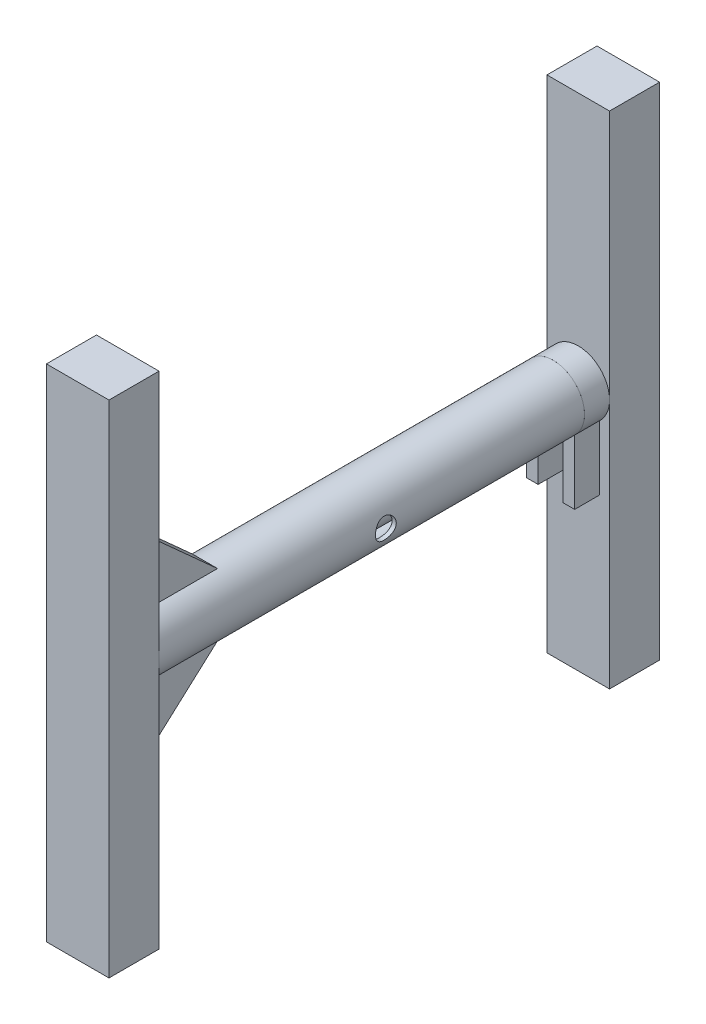
from build123d import *

# Parameters (mm, degrees)
SKETCH1_W              = 25
SKETCH1_H              = 200
BOSS_EXTRUDE1_DEPTH    = 20
BOSS_EXTRUDE2_START    = 200
SKETCH1_2_W            = 25
SKETCH1_2_H            = 200
BOSS_EXTRUDE2_DEPTH    = 20
SKETCH3_R              = 7.5
BOSS_EXTRUDE4_DEPTH    = 180
SKETCH4_R              = 12.5
SKETCH4_R_2            = 10.847914671
BOSS_EXTRUDE6_DEPTH    = 170
CUT_EXTRUDE1_START     = 8
SKETCH5_R              = 4.15951276
CUT_EXTRUDE1_DEPTH     = 206
SKETCH9_R              = 12.5
BOSS_EXTRUDE7_DEPTH    = 10
SKETCH10_W             = 4.542152159
SKETCH10_H             = 38.840988947
BOSS_EXTRUDE8_DEPTH    = 10
SKETCH10_W_2           = 4.617563116
SKETCH10_H_2           = 40.163970658
BOSS_EXTRUDE8_2_DEPTH  = 10
BOSS_EXTRUDE10_DEPTH   = 5
BOSS_EXTRUDE10_2_DEPTH = 5


with BuildPart() as part:
    # Sketch1 → Boss-Extrude1 (new body)
    with BuildSketch(Plane.XY):
        Rectangle(SKETCH1_W, SKETCH1_H)
    extrude(amount=BOSS_EXTRUDE1_DEPTH)



with BuildPart() as body_2:
    # Sketch1<2> → Boss-Extrude2 (new body)
    with BuildSketch(Plane.XY.offset(BOSS_EXTRUDE2_START)):
        Rectangle(SKETCH1_2_W, SKETCH1_2_H)
    extrude(amount=BOSS_EXTRUDE2_DEPTH)


with BuildPart() as part_1:
    add(part.part)

    add(body_2.part)  # Boss-Extrude4 merges body 2
    # Sketch3 → Boss-Extrude4 (add)
    with BuildSketch(Plane(origin=(0, 0, 200), x_dir=(-1, 0, 0), z_dir=(0, 0, -1))):
        with Locations(Location((0, 0, 0), (0, 0, 180))):
            Circle(SKETCH3_R)
    extrude(amount=BOSS_EXTRUDE4_DEPTH)


with BuildPart() as body_2_2:
    # Sketch4 → Boss-Extrude6 (new body)
    with BuildSketch(Plane(origin=(0, 0, 200), x_dir=(-1, 0, 0), z_dir=(0, 0, -1))):
        Circle(SKETCH4_R)
        Circle(SKETCH4_R_2, mode=Mode.SUBTRACT)
    extrude(amount=BOSS_EXTRUDE6_DEPTH)

    # Sketch5 → Cut-Extrude1 (cut)
    with BuildSketch(Plane(origin=(0, 0, 0), x_dir=(0, 0, -1), z_dir=(1, 0, 0)).offset(CUT_EXTRUDE1_START)):
        with Locations((-109.366831525, 0)):
            Circle(SKETCH5_R)
    extrude(amount=CUT_EXTRUDE1_DEPTH, mode=Mode.SUBTRACT)


with BuildPart() as body_3:
    # Sketch9 → Boss-Extrude7 (new body)
    with BuildSketch(Plane.XY.offset(20)):
        Circle(SKETCH9_R)
    extrude(amount=BOSS_EXTRUDE7_DEPTH)


with BuildPart() as body_4:
    # Sketch10 → Boss-Extrude8 (new body)
    with BuildSketch(Plane.XY.offset(20)):
        with Locations((-8.306447613, -14.074886259)):
            Rectangle(SKETCH10_W, SKETCH10_H)
    extrude(amount=BOSS_EXTRUDE8_DEPTH)


with BuildPart() as body_5:
    # Sketch10 → Boss-Extrude8 2 (new body)
    with BuildSketch(Plane.XY.offset(20)):
        with Locations((6.256640597, -14.736377114)):
            Rectangle(SKETCH10_W_2, SKETCH10_H_2)
    extrude(amount=BOSS_EXTRUDE8_2_DEPTH)


with BuildPart() as body_6:
    # Sketch13 → Boss-Extrude10 (new, symmetric)
    with BuildSketch(Plane(origin=(0, 0, 0), x_dir=(0, 0, -1), z_dir=(1, 0, 0))):
        Polygon((-200, 40.323059988), (-169.121721381, 12.5), (-200, 12.5), align=None)
    extrude(amount=BOSS_EXTRUDE10_DEPTH, both=True)


with BuildPart() as body_7:
    # Sketch13 → Boss-Extrude10 2 (new, symmetric)
    with BuildSketch(Plane(origin=(0, 0, 0), x_dir=(0, 0, -1), z_dir=(1, 0, 0))):
        Polygon((-169.121721381, -12.5), (-200, -12.5), (-200, -40.323059988), align=None)
    extrude(amount=BOSS_EXTRUDE10_2_DEPTH, both=True)


solid = Compound([part_1.part, body_2_2.part, body_3.part, body_4.part, body_5.part, body_6.part, body_7.part])
